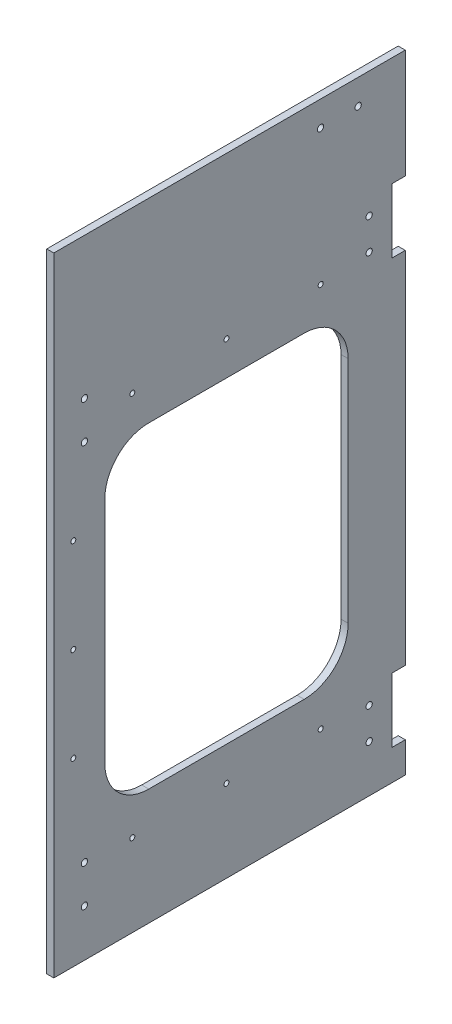
from build123d import *

# Parameters (mm, degrees)
SKETCH_1_W          = 223.9
SKETCH_1_H          = 400
EXTRUDE_1_DEPTH     = 4.5
SKETCH_2_R          = 2
SKETCH_2_W          = 8.5
SKETCH_2_H          = 41
CUT_EXTRUDE_1_DEPTH = 10
CUT_EXTRUDE_2_REACH = 460.423
SKETCH_3_R          = 1.6


with BuildPart() as part:
    # 草图1 → 凸台-拉伸1 (new body)
    with BuildSketch(Plane(origin=(0, 0, 0), x_dir=(0, 0, -1), z_dir=(1, 0, 0))):
        with Locations((-111.95, 200)):
            Rectangle(SKETCH_1_W, SKETCH_1_H)
    extrude(amount=EXTRUDE_1_DEPTH)

    # 草图2 → 切除-拉伸1 (cut)
    with BuildSketch(Plane(origin=(4.5, 0, 0), x_dir=(0, 0, -1), z_dir=(1, 0, 0))):
        with Locations((-204.4, 310)):
            Circle(SKETCH_2_R)
        with Locations((-204.4, 286)):
            Circle(SKETCH_2_R)
        with Locations((-204.4, 54)):
            Circle(SKETCH_2_R)
        with Locations((-204.4, 30)):
            Circle(SKETCH_2_R)
        with Locations((-54, 384)):
            Circle(SKETCH_2_R)
        with Locations((-30, 384)):
            Circle(SKETCH_2_R)
        with Locations((-23, 320)):
            Circle(SKETCH_2_R)
        with Locations((-23, 300)):
            Circle(SKETCH_2_R)
        with Locations((-23, 50)):
            Circle(SKETCH_2_R)
        with Locations((-23, 30)):
            Circle(SKETCH_2_R)
        with Locations((-4.25, 310)):
            Rectangle(SKETCH_2_W, SKETCH_2_H)
        with Locations((-4.25, 40)):
            Rectangle(SKETCH_2_W, SKETCH_2_H)
    extrude(amount=-CUT_EXTRUDE_1_DEPTH, mode=Mode.SUBTRACT)

    # 草图3 → 切除-拉伸2 (cut, up to next)
    with BuildSketch(Plane(origin=(4.5, 0, 0), x_dir=(0, 0, -1), z_dir=(1, 0, 0)), mode=Mode.PRIVATE) as cut_extrude_2_sk1:
        with Locations((-211.5, 175)):
            Circle(SKETCH_3_R)
    cut_extrude_2_tool1 = extrude(cut_extrude_2_sk1.sketch, amount=-CUT_EXTRUDE_2_REACH, mode=Mode.PRIVATE) & part.part
    # 草图3 → 切除-拉伸2 (cut, up to next)
    with BuildSketch(Plane(origin=(4.5, 0, 0), x_dir=(0, 0, -1), z_dir=(1, 0, 0)), mode=Mode.PRIVATE) as cut_extrude_2_sk2:
        with Locations((-211.5, 235)):
            Circle(SKETCH_3_R)
    cut_extrude_2_tool2 = extrude(cut_extrude_2_sk2.sketch, amount=-CUT_EXTRUDE_2_REACH, mode=Mode.PRIVATE) & part.part
    # 草图3 → 切除-拉伸2 (cut, up to next)
    with BuildSketch(Plane(origin=(4.5, 0, 0), x_dir=(0, 0, -1), z_dir=(1, 0, 0)), mode=Mode.PRIVATE) as cut_extrude_2_sk3:
        with Locations((-211.5, 115)):
            Circle(SKETCH_3_R)
    cut_extrude_2_tool3 = extrude(cut_extrude_2_sk3.sketch, amount=-CUT_EXTRUDE_2_REACH, mode=Mode.PRIVATE) & part.part
    # 草图3 → 切除-拉伸2 (cut, up to next)
    with BuildSketch(Plane(origin=(4.5, 0, 0), x_dir=(0, 0, -1), z_dir=(1, 0, 0)), mode=Mode.PRIVATE) as cut_extrude_2_sk4:
        with Locations((-173.9, 297.6)):
            Circle(SKETCH_3_R)
    cut_extrude_2_tool4 = extrude(cut_extrude_2_sk4.sketch, amount=-CUT_EXTRUDE_2_REACH, mode=Mode.PRIVATE) & part.part
    # 草图3 → 切除-拉伸2 (cut, up to next)
    with BuildSketch(Plane(origin=(4.5, 0, 0), x_dir=(0, 0, -1), z_dir=(1, 0, 0)), mode=Mode.PRIVATE) as cut_extrude_2_sk5:
        with Locations((-53.9, 297.6)):
            Circle(SKETCH_3_R)
    cut_extrude_2_tool5 = extrude(cut_extrude_2_sk5.sketch, amount=-CUT_EXTRUDE_2_REACH, mode=Mode.PRIVATE) & part.part
    # 草图3 → 切除-拉伸2 (cut, up to next)
    with BuildSketch(Plane(origin=(4.5, 0, 0), x_dir=(0, 0, -1), z_dir=(1, 0, 0)), mode=Mode.PRIVATE) as cut_extrude_2_sk6:
        with Locations((-53.9, 52.4)):
            Circle(SKETCH_3_R)
    cut_extrude_2_tool6 = extrude(cut_extrude_2_sk6.sketch, amount=-CUT_EXTRUDE_2_REACH, mode=Mode.PRIVATE) & part.part
    # 草图3 → 切除-拉伸2 (cut, up to next)
    with BuildSketch(Plane(origin=(4.5, 0, 0), x_dir=(0, 0, -1), z_dir=(1, 0, 0)), mode=Mode.PRIVATE) as cut_extrude_2_sk7:
        with Locations((-173.9, 52.4)):
            Circle(SKETCH_3_R)
    cut_extrude_2_tool7 = extrude(cut_extrude_2_sk7.sketch, amount=-CUT_EXTRUDE_2_REACH, mode=Mode.PRIVATE) & part.part
    # 草图3 → 切除-拉伸2 (cut, up to next)
    with BuildSketch(Plane(origin=(4.5, 0, 0), x_dir=(0, 0, -1), z_dir=(1, 0, 0)), mode=Mode.PRIVATE) as cut_extrude_2_sk8:
        with Locations((-113.9, 297.6)):
            Circle(SKETCH_3_R)
    cut_extrude_2_tool8 = extrude(cut_extrude_2_sk8.sketch, amount=-CUT_EXTRUDE_2_REACH, mode=Mode.PRIVATE) & part.part
    # 草图3 → 切除-拉伸2 (cut, up to next)
    with BuildSketch(Plane(origin=(4.5, 0, 0), x_dir=(0, 0, -1), z_dir=(1, 0, 0)), mode=Mode.PRIVATE) as cut_extrude_2_sk9:
        with Locations((-113.9, 52.4)):
            Circle(SKETCH_3_R)
    cut_extrude_2_tool9 = extrude(cut_extrude_2_sk9.sketch, amount=-CUT_EXTRUDE_2_REACH, mode=Mode.PRIVATE) & part.part
    # 草图3 → 切除-拉伸2 (cut, up to next)
    with BuildSketch(Plane(origin=(4.5, 0, 0), x_dir=(0, 0, -1), z_dir=(1, 0, 0)), mode=Mode.PRIVATE) as cut_extrude_2_sk10:
        with BuildLine():
            Line((-64.4, 74), (-163.4, 74))
            ThreePointArc((-163.4, 74), (-183.198989873, 82.201010127), (-191.4, 102))
            Line((-191.4, 102), (-191.4, 248))
            ThreePointArc((-191.4, 248), (-183.198989873, 267.798989873), (-163.4, 276))
            Line((-163.4, 276), (-64.4, 276))
            ThreePointArc((-64.4, 276), (-44.601010127, 267.798989873), (-36.4, 248))
            Line((-36.4, 248), (-36.4, 102))
            ThreePointArc((-36.4, 102), (-44.601010127, 82.201010127), (-64.4, 74))
        make_face()
    cut_extrude_2_tool10 = extrude(cut_extrude_2_sk10.sketch, amount=-CUT_EXTRUDE_2_REACH, mode=Mode.PRIVATE) & part.part
    add(cut_extrude_2_tool1.solids().sort_by_distance((4.5, 175, 211.5))[0], mode=Mode.SUBTRACT)
    add(cut_extrude_2_tool2.solids().sort_by_distance((4.5, 235, 211.5))[0], mode=Mode.SUBTRACT)
    add(cut_extrude_2_tool3.solids().sort_by_distance((4.5, 115, 211.5))[0], mode=Mode.SUBTRACT)
    add(cut_extrude_2_tool4.solids().sort_by_distance((4.5, 297.6, 173.9))[0], mode=Mode.SUBTRACT)
    add(cut_extrude_2_tool5.solids().sort_by_distance((4.5, 297.6, 53.9))[0], mode=Mode.SUBTRACT)
    add(cut_extrude_2_tool6.solids().sort_by_distance((4.5, 52.4, 53.9))[0], mode=Mode.SUBTRACT)
    add(cut_extrude_2_tool7.solids().sort_by_distance((4.5, 52.4, 173.9))[0], mode=Mode.SUBTRACT)
    add(cut_extrude_2_tool8.solids().sort_by_distance((4.5, 297.6, 113.9))[0], mode=Mode.SUBTRACT)
    add(cut_extrude_2_tool9.solids().sort_by_distance((4.5, 52.4, 113.9))[0], mode=Mode.SUBTRACT)
    add(cut_extrude_2_tool10.solids().sort_by_distance((4.5, 175, 113.9))[0], mode=Mode.SUBTRACT)


solid = part.part
